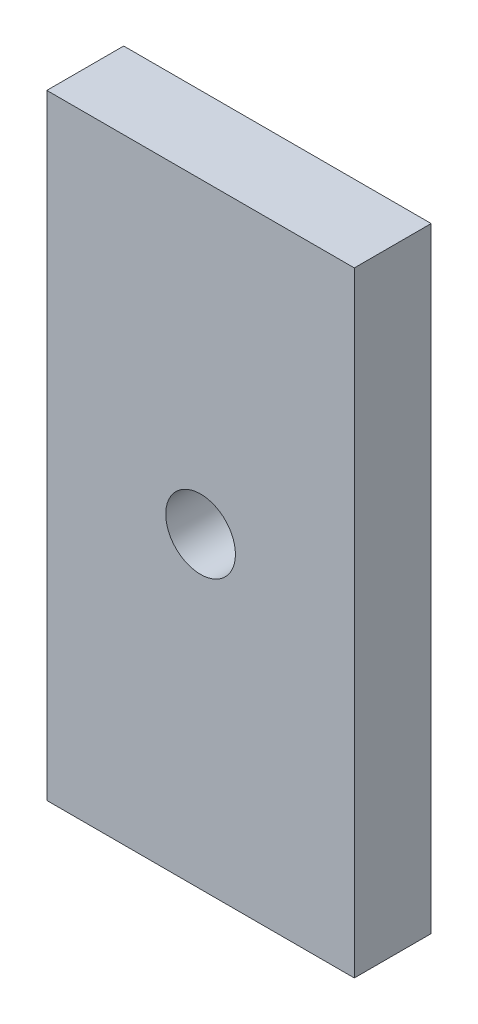
from build123d import *

# Parameters (mm, degrees)
SKETCH2_W           = 38.1
SKETCH2_H           = 76.2
BOSS_EXTRUDE1_DEPTH = 9.525
SKETCH3_OUTSIDE_W   = 57.246
SKETCH3_OUTSIDE_H   = 95.346
SKETCH3_OUTSIDE_W_2 = 38.1
SKETCH3_OUTSIDE_H_2 = 76.2
SKETCH3_OUTSIDE_R   = 4.318
CUT_EXTRUDE2_DEPTH  = 12.7


with BuildPart() as part:
    # Sketch2 → Boss-Extrude1 (new body)
    with BuildSketch(Plane.XY):
        Rectangle(SKETCH2_W, SKETCH2_H)
    extrude(amount=BOSS_EXTRUDE1_DEPTH)

    # Sketch3 outside → Cut-Extrude2 (cut)
    # profile 1 of 2: a face of its own
    with BuildSketch(Plane.XY.offset(9.525)):
        Rectangle(SKETCH3_OUTSIDE_W, SKETCH3_OUTSIDE_H)
        Rectangle(SKETCH3_OUTSIDE_W_2, SKETCH3_OUTSIDE_H_2, mode=Mode.SUBTRACT)
    # profile 2 of 2: a face of its own
    with BuildSketch(Plane.XY.offset(9.525)):
        Circle(SKETCH3_OUTSIDE_R)
    extrude(amount=-CUT_EXTRUDE2_DEPTH, mode=Mode.SUBTRACT)


solid = part.part
